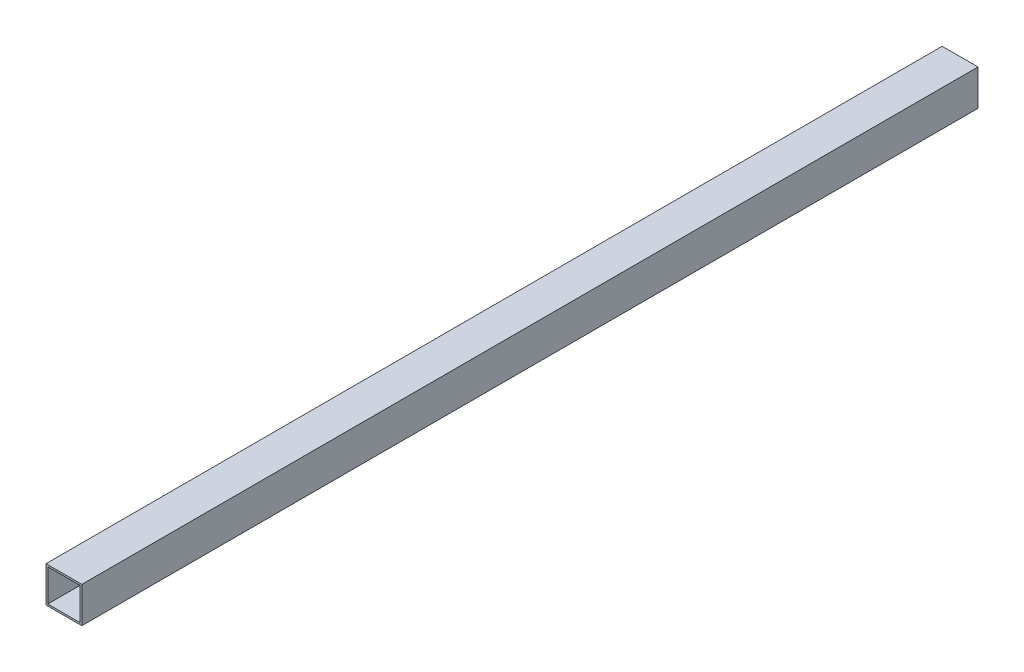
from build123d import *

# Parameters (mm, degrees)
CROQUIS1_W            = 40
CROQUIS1_H            = 40
CROQUIS1_W_2          = 36
CROQUIS1_H_2          = 36
EXTRUIR_L_MINA1_DEPTH = 1000


with BuildPart() as part:
    # Croquis1 → Extruir-Lámina1 (new body)
    with BuildSketch(Plane.XY):
        Rectangle(CROQUIS1_W, CROQUIS1_H)
        Rectangle(CROQUIS1_W_2, CROQUIS1_H_2, mode=Mode.SUBTRACT)
    extrude(amount=EXTRUIR_L_MINA1_DEPTH)


solid = part.part
